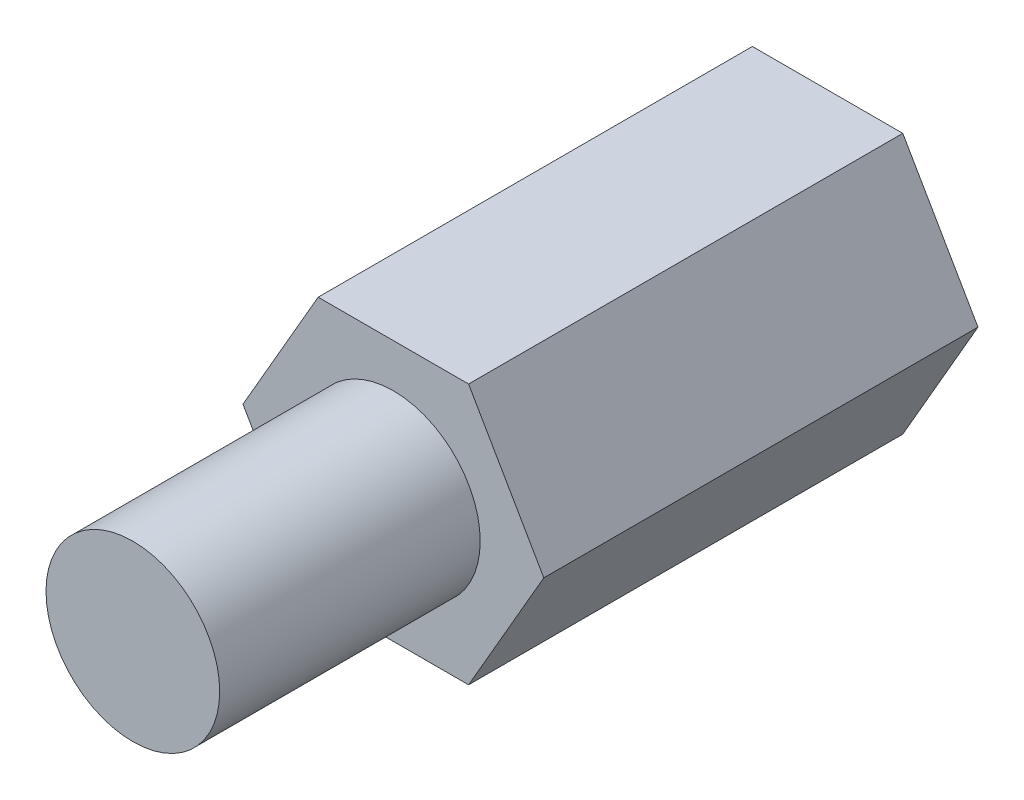
from build123d import *

# Parameters (mm, degrees)
EXTRUDE_1_DEPTH        = 5
SKETCH_2_R             = 1
EXTRUDE_2_DEPTH        = 3
HOLE_WIZARD_M2_1_D     = 2.4
HOLE_WIZARD_M2_1_DEPTH = 3
HOLE_WIZARD_M2_1_TIP   = 0.721032743


with BuildPart() as part:
    # 스케치1 → 보스-돌출1 (new body)
    with BuildSketch(Plane.XY):
        Polygon((0.866025404, -1.5), (1.732050808, 0), (0.866025404, 1.5), (-0.866025404, 1.5), (-1.732050808, 0), (-0.866025404, -1.5), align=None)
    extrude(amount=EXTRUDE_1_DEPTH)

    # 스케치2 → 보스-돌출2 (add)
    with BuildSketch(Plane.XY.offset(5)):
        Circle(SKETCH_2_R)
    extrude(amount=EXTRUDE_2_DEPTH)

    # M2 여유 구멍1
    with Locations(Plane(origin=(0, 0, 0), x_dir=(-1, 0, 0), z_dir=(0, 0, -1))):
        with Locations((0, 0)):
            Hole(HOLE_WIZARD_M2_1_D / 2, depth=HOLE_WIZARD_M2_1_DEPTH)
            with Locations((0, 0, -(HOLE_WIZARD_M2_1_DEPTH + HOLE_WIZARD_M2_1_TIP / 2))):  # 118° drill point
                Cone(0, HOLE_WIZARD_M2_1_D / 2, HOLE_WIZARD_M2_1_TIP, mode=Mode.SUBTRACT)


solid = part.part
